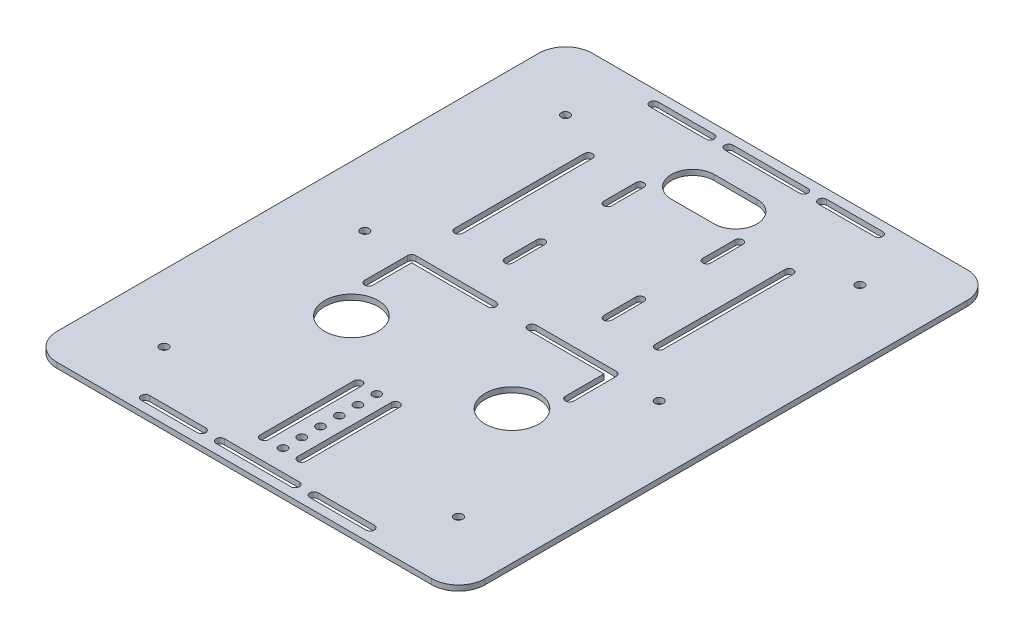
from build123d import *

# Parameters (mm, degrees)
SKETCH_1_R          = 1.55
SKETCH_1_R_2        = 10
SKETCH_1_R_3        = 1.6
EXTRUDE_1_DEPTH     = 2
CUT_EXTRUDE_1_DEPTH = 10


with BuildPart() as part:
    # 草图1 → 凸台-拉伸1 (new body)
    with BuildSketch(Plane.XZ):
        with BuildLine():
            Line((-70, -100), (70, -100))
            ThreePointArc((70, -100), (77.071067812, -97.071067812), (80, -90))
            Line((80, -90), (80, 90))
            ThreePointArc((80, 90), (77.071067812, 97.071067812), (70, 100))
            Line((70, 100), (-70, 100))
            ThreePointArc((-70, 100), (-77.071067812, 97.071067812), (-80, 90))
            Line((-80, 90), (-80, -90))
            ThreePointArc((-80, -90), (-77.071067812, -97.071067812), (-70, -100))
        make_face()
        with Locations(Location((0, 50.5527, 0), (0, 0, 90))):
            Circle(SKETCH_1_R, mode=Mode.SUBTRACT)
        with Locations(Location((0, 57.5527, 0), (0, 0, 90))):
            Circle(SKETCH_1_R, mode=Mode.SUBTRACT)
        with Locations(Location((0, 64.5527, 0), (0, 0, 90))):
            Circle(SKETCH_1_R, mode=Mode.SUBTRACT)
        with Locations(Location((0, 71.5527, 0), (0, 0, 90))):
            Circle(SKETCH_1_R, mode=Mode.SUBTRACT)
        with Locations(Location((0, 78.5527, 0), (0, 0, 90))):
            Circle(SKETCH_1_R, mode=Mode.SUBTRACT)
        with Locations(Location((0, 85.5527, 0), (0, 0, 90))):
            Circle(SKETCH_1_R, mode=Mode.SUBTRACT)
        with Locations(Location((-30, 30, 0), (0, 0, 90))):
            Circle(SKETCH_1_R_2, mode=Mode.SUBTRACT)
        with Locations(Location((30, 30, 0), (0, 0, 90))):
            Circle(SKETCH_1_R_2, mode=Mode.SUBTRACT)
        with Locations(Location((55, 75, 0), (0, 0, 90))):
            Circle(SKETCH_1_R_3, mode=Mode.SUBTRACT)
        with Locations(Location((55, 0, 0), (0, 0, 90))):
            Circle(SKETCH_1_R_3, mode=Mode.SUBTRACT)
        with Locations(Location((55, -75, 0), (0, 0, 90))):
            Circle(SKETCH_1_R_3, mode=Mode.SUBTRACT)
        with Locations(Location((-55, -75, 0), (0, 0, 90))):
            Circle(SKETCH_1_R_3, mode=Mode.SUBTRACT)
        with Locations(Location((-55, 0, 0), (0, 0, 90))):
            Circle(SKETCH_1_R_3, mode=Mode.SUBTRACT)
        with Locations(Location((-55, 75, 0), (0, 0, 90))):
            Circle(SKETCH_1_R_3, mode=Mode.SUBTRACT)
        with BuildLine():
            Line((37.5, -1.55), (7.5, -1.55))
            ThreePointArc((7.5, -1.55), (5.95, 0), (7.5, 1.55))
            Line((7.5, 1.55), (35.95, 1.55))
            Line((35.95, 1.55), (35.95, 16))
            ThreePointArc((35.95, 16), (37.5, 17.55), (39.05, 16))
            Line((39.05, 16), (39.05, 0))
            ThreePointArc((39.05, 0), (38.596015511, -1.096015511), (37.5, -1.55))
        make_face(mode=Mode.SUBTRACT)
        with BuildLine():
            Line((-35.95, 1.55), (-35.95, 16))
            ThreePointArc((-35.95, 16), (-37.5, 17.55), (-39.05, 16))
            Line((-39.05, 16), (-39.05, 0))
            ThreePointArc((-39.05, 0), (-38.596015511, -1.096015511), (-37.5, -1.55))
            Line((-37.5, -1.55), (-7.5, -1.55))
            ThreePointArc((-7.5, -1.55), (-5.95, 0), (-7.5, 1.55))
            Line((-7.5, 1.55), (-35.95, 1.55))
        make_face(mode=Mode.SUBTRACT)
        with BuildLine():
            Line((39.05, -66), (39.05, -17.55))
            ThreePointArc((39.05, -17.55), (37.5, -16), (35.95, -17.55))
            Line((35.95, -17.55), (35.95, -66))
            ThreePointArc((35.95, -66), (37.5, -67.55), (39.05, -66))
        make_face(mode=Mode.SUBTRACT)
        with BuildLine():
            Line((-35.95, -17.55), (-35.95, -66))
            ThreePointArc((-35.95, -66), (-37.5, -67.55), (-39.05, -66))
            Line((-39.05, -66), (-39.05, -17.55))
            ThreePointArc((-39.05, -17.55), (-37.5, -16), (-35.95, -17.55))
        make_face(mode=Mode.SUBTRACT)
        with BuildLine():
            Line((8, -83.55), (-8, -83.55))
            ThreePointArc((-8, -83.55), (-16, -75.55), (-8, -67.55))
            Line((-8, -67.55), (8, -67.55))
            ThreePointArc((8, -67.55), (16, -75.55), (8, -83.55))
        make_face(mode=Mode.SUBTRACT)
        with BuildLine():
            Line((8.55, 85.5527), (8.55, 50.5527))
            ThreePointArc((8.55, 50.5527), (7, 49.0027), (5.45, 50.5527))
            Line((5.45, 50.5527), (5.45, 85.5527))
            ThreePointArc((5.45, 85.5527), (7, 87.1027), (8.55, 85.5527))
        make_face(mode=Mode.SUBTRACT)
        with BuildLine():
            Line((-8.55, 50.5527), (-8.55, 85.5527))
            ThreePointArc((-8.55, 85.5527), (-7, 87.1027), (-5.45, 85.5527))
            Line((-5.45, 85.5527), (-5.45, 50.5527))
            ThreePointArc((-5.45, 50.5527), (-7, 49.0027), (-8.55, 50.5527))
        make_face(mode=Mode.SUBTRACT)
        with BuildLine():
            Line((42, 93.45), (21, 93.45))
            ThreePointArc((21, 93.45), (19.45, 95), (21, 96.55))
            Line((21, 96.55), (42, 96.55))
            ThreePointArc((42, 96.55), (43.55, 95), (42, 93.45))
        make_face(mode=Mode.SUBTRACT)
        with BuildLine():
            Line((-21, 93.45), (-42, 93.45))
            ThreePointArc((-42, 93.45), (-43.55, 95), (-42, 96.55))
            Line((-42, 96.55), (-21, 96.55))
            ThreePointArc((-21, 96.55), (-19.45, 95), (-21, 93.45))
        make_face(mode=Mode.SUBTRACT)
        with BuildLine():
            Line((14, 93.45), (-14, 93.45))
            ThreePointArc((-14, 93.45), (-15.55, 95), (-14, 96.55))
            Line((-14, 96.55), (14, 96.55))
            ThreePointArc((14, 96.55), (15.55, 95), (14, 93.45))
        make_face(mode=Mode.SUBTRACT)
        with BuildLine():
            Line((21, -93.45), (42, -93.45))
            ThreePointArc((42, -93.45), (43.55, -95), (42, -96.55))
            Line((42, -96.55), (21, -96.55))
            ThreePointArc((21, -96.55), (19.45, -95), (21, -93.45))
        make_face(mode=Mode.SUBTRACT)
        with BuildLine():
            Line((-42, -93.45), (-21, -93.45))
            ThreePointArc((-21, -93.45), (-19.45, -95), (-21, -96.55))
            Line((-21, -96.55), (-42, -96.55))
            ThreePointArc((-42, -96.55), (-43.55, -95), (-42, -93.45))
        make_face(mode=Mode.SUBTRACT)
        with BuildLine():
            Line((-14, -93.45), (14, -93.45))
            ThreePointArc((14, -93.45), (15.55, -95), (14, -96.55))
            Line((14, -96.55), (-14, -96.55))
            ThreePointArc((-14, -96.55), (-15.55, -95), (-14, -93.45))
        make_face(mode=Mode.SUBTRACT)
    extrude(amount=-EXTRUDE_1_DEPTH)

    # 草图2 → 切除-拉伸1 (cut)
    with BuildSketch(Plane.XZ):
        with BuildLine():
            Line((-17, -17.275), (-17, -29.275))
            ThreePointArc((-17, -29.275), (-18.5, -30.775), (-20, -29.275))
            Line((-20, -29.275), (-20, -17.275))
            ThreePointArc((-20, -17.275), (-18.5, -15.775), (-17, -17.275))
        make_face()
        with BuildLine():
            Line((-17, -54.275), (-17, -66.275))
            ThreePointArc((-17, -66.275), (-18.5, -67.775), (-20, -66.275))
            Line((-20, -66.275), (-20, -54.275))
            ThreePointArc((-20, -54.275), (-18.5, -52.775), (-17, -54.275))
        make_face()
        with BuildLine():
            Line((17, -54.275), (17, -66.275))
            ThreePointArc((17, -66.275), (18.5, -67.775), (20, -66.275))
            Line((20, -66.275), (20, -54.275))
            ThreePointArc((20, -54.275), (18.5, -52.775), (17, -54.275))
        make_face()
        with BuildLine():
            Line((17, -17.275), (17, -29.275))
            ThreePointArc((17, -29.275), (18.5, -30.775), (20, -29.275))
            Line((20, -29.275), (20, -17.275))
            ThreePointArc((20, -17.275), (18.5, -15.775), (17, -17.275))
        make_face()
    extrude(amount=-CUT_EXTRUDE_1_DEPTH, mode=Mode.SUBTRACT)


solid = part.part
